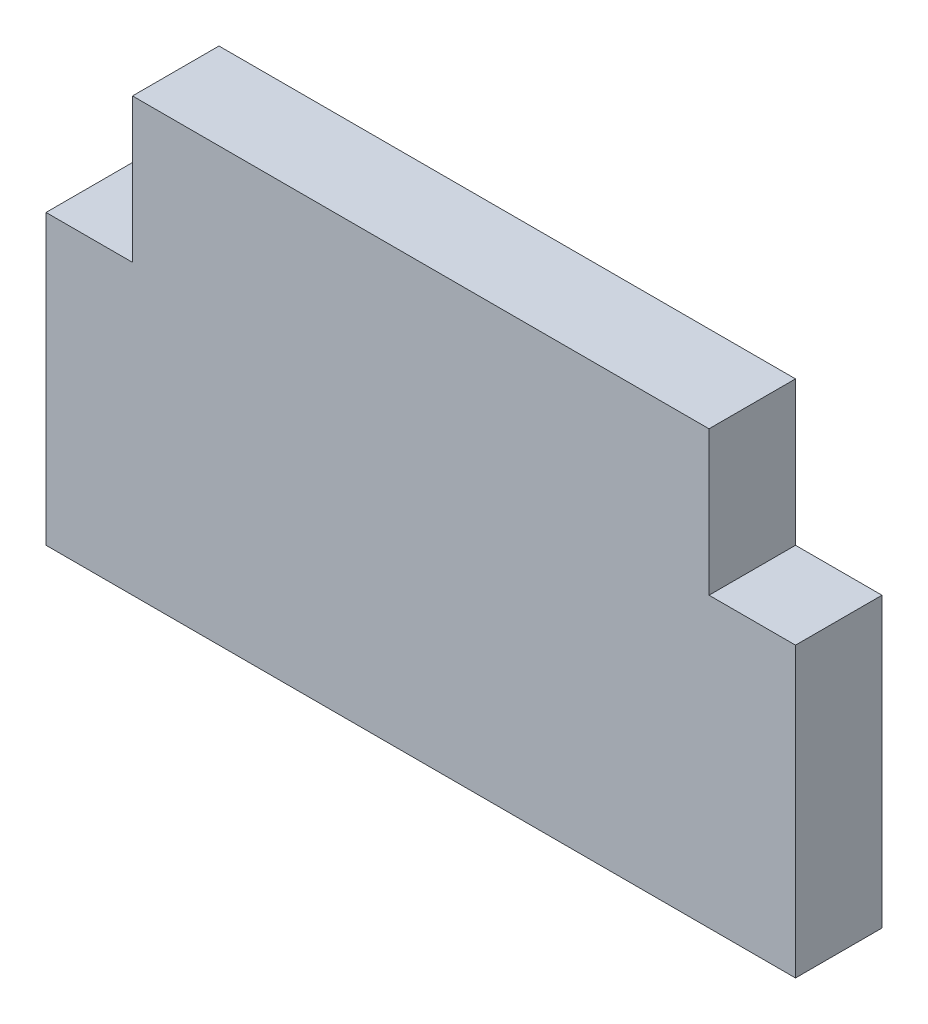
from build123d import *

# Parameters (mm, degrees)
SKETCH_1_W      = 20
SKETCH_1_H      = 15
SKETCH_1_W_2    = 3
SKETCH_1_H_2    = 10
EXTRUDE_1_DEPTH = 3


with BuildPart() as part:
    # 草图1 → 凸台-拉伸1 (new body)
    with BuildSketch(Plane.XY):
        Rectangle(SKETCH_1_W, SKETCH_1_H)
        with Locations((11.5, -2.5)):
            Rectangle(SKETCH_1_W_2, SKETCH_1_H_2)
        with Locations((-11.5, -2.5)):
            Rectangle(SKETCH_1_W_2, SKETCH_1_H_2)
    extrude(amount=EXTRUDE_1_DEPTH)


solid = part.part
